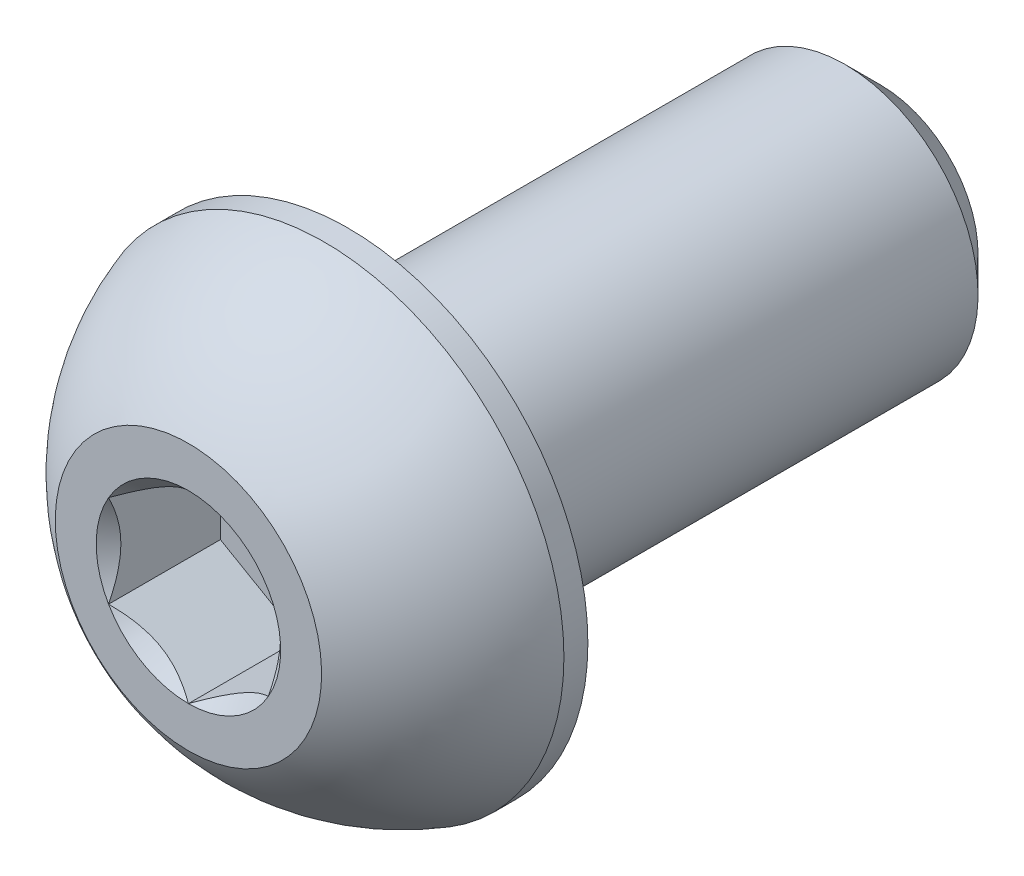
from build123d import *

# Parameters (mm, degrees)
SKETCH1_W          = 5
SKETCH1_H          = 1.25
CHAMFER1_SIZE      = 0.3375
CUT_EXTRUDE2_DEPTH = 1.05


with BuildPart() as part:
    # Sketch1 → Revolve1 (revolve)
    with BuildSketch(Plane(origin=(0, 0, 0), x_dir=(0, 0, -1), z_dir=(1, 0, 0))):
        with Locations((4, 0.625)):
            Rectangle(SKETCH1_W, SKETCH1_H)
    revolve(axis=Axis((0, 0, -6.5), (0, 0, 1)))

    # Chamfer1
    chamfer1_edges = [part.edges().sort_by_distance(p)[0] for p in [
        (0, -1.25, -6.5),
    ]]
    chamfer(chamfer1_edges, length=CHAMFER1_SIZE)

    # Sketch7 → Revolve2 (revolve)
    with BuildSketch(Plane(origin=(0, 0, 0), x_dir=(0, 0, -1), z_dir=(1, 0, 0))):
        with BuildLine():
            Line((1.275, 2.25), (1.5, 2.25))
            Line((1.5, 2.25), (1.5, 0))
            Line((1.5, 0), (0, 0))
            Line((0, 0), (0, 1.25))
            ThreePointArc((0, 1.25), (0.549264706, 1.8625), (1.275, 2.25))
        make_face()
    revolve(axis=Axis((0, 0, 0), (0, 0, -1)))

    # Sketch5 → Cut-Extrude2 (cut)
    with BuildSketch(Plane.XY):
        Polygon((0.75, -0.433012702), (0.75, 0.433012702), (0, 0.866025404), (-0.75, 0.433012702), (-0.75, -0.433012702), (0, -0.866025404), align=None)
    extrude(amount=-CUT_EXTRUDE2_DEPTH, mode=Mode.SUBTRACT)

    # Cut-Extrude3 cone 1 section (through the dimple's axis) → Cut-Extrude3 (revolve, cut)
    with BuildSketch(Plane(origin=(0, 0, 0), x_dir=(0, -1, 0), z_dir=(1, 0, 0))):
        Polygon((0, 0), (0.866025404, 0), (0, 0.866025404), align=None)
    revolve(axis=Axis((0, 0, 0), (0, 0, -1)), mode=Mode.SUBTRACT)


solid = part.part
